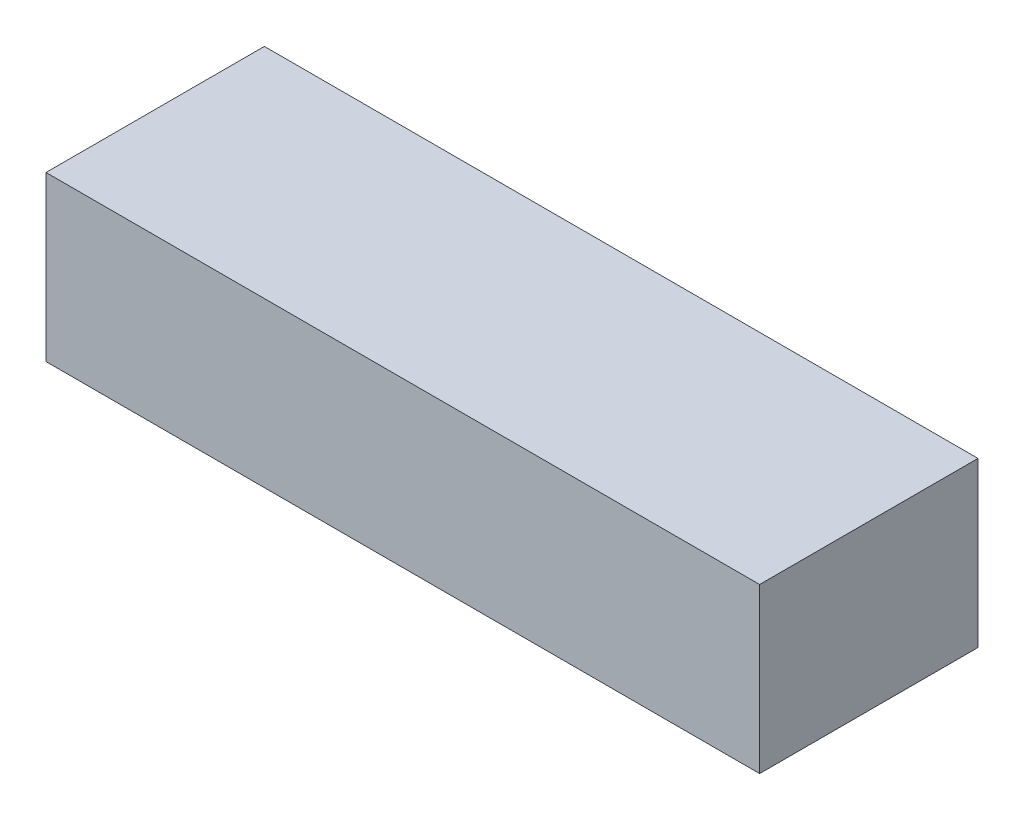
from build123d import *

# Parameters (mm, degrees)
SKETCH1_W           = 915
SKETCH1_H           = 280
BOSS_EXTRUDE1_DEPTH = 210


with BuildPart() as part:
    # Sketch1 → Boss-Extrude1 (new body)
    with BuildSketch(Plane(origin=(0, 0, 0), x_dir=(1, 0, 0), z_dir=(0, 1, 0))):
        with Locations((0, 140)):
            Rectangle(SKETCH1_W, SKETCH1_H)
    extrude(amount=-BOSS_EXTRUDE1_DEPTH)


solid = part.part
